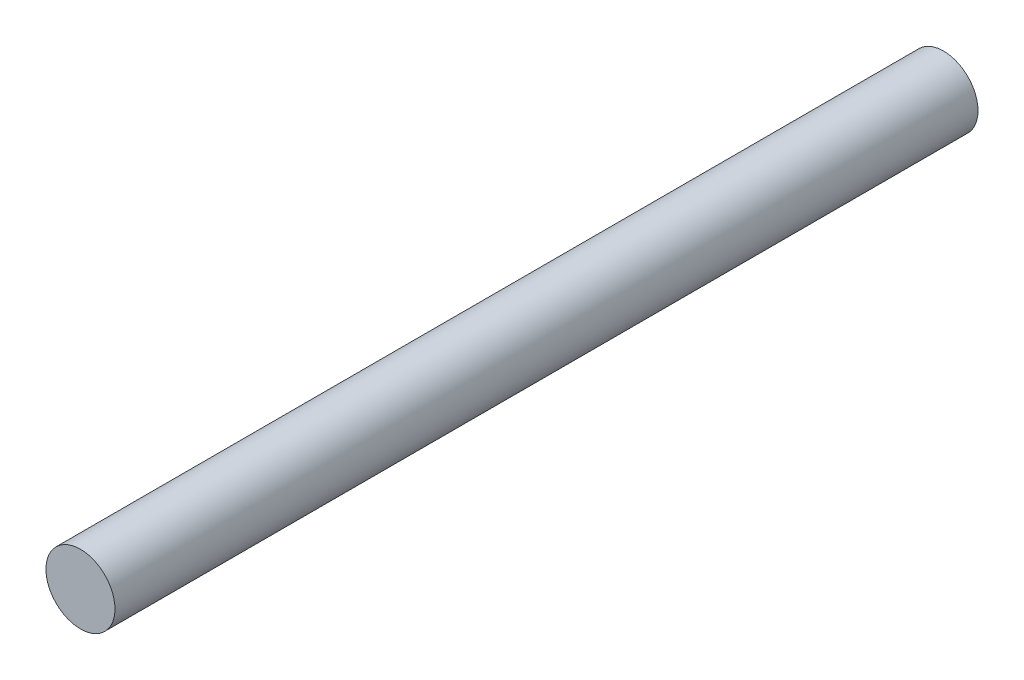
from build123d import *

# Parameters (mm, degrees)
ESQUISSE1_R        = 20
BOSS_EXTRU_1_DEPTH = 500


with BuildPart() as part:
    # Esquisse1 → Boss.-Extru.1 (new body)
    with BuildSketch(Plane.XY):
        Circle(ESQUISSE1_R)
    extrude(amount=BOSS_EXTRU_1_DEPTH)


solid = part.part
